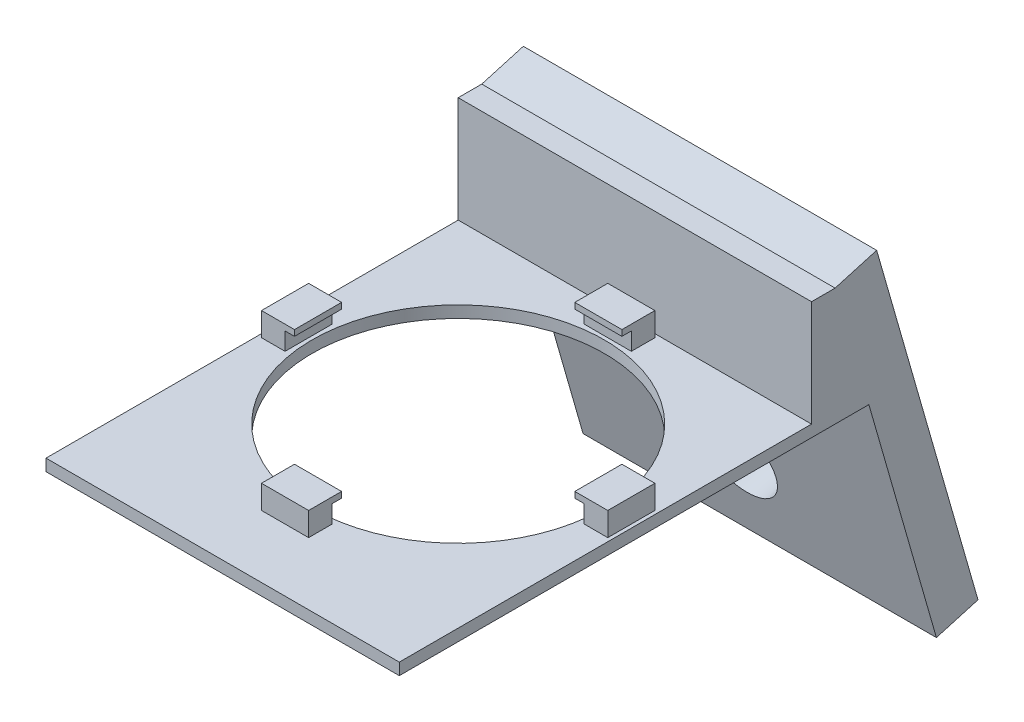
from build123d import *

# Parameters (mm, degrees)
SKETCH1_W               = 30
SKETCH1_H               = 30
BOSS_EXTRUDE1_DEPTH     = 1
SKETCH2_R               = 12.4
CUT_EXTRUDE1_DEPTH      = 22.236760582
SKETCH4_W               = 2
SKETCH4_H               = 4
SKETCH4_W_2             = 4
SKETCH4_H_2             = 2
BOSS_EXTRUDE2_DEPTH     = 2
SKETCH5_W               = 4
SKETCH5_H               = 0.5
BOSS_EXTRUDE3_DEPTH     = 0.8
SKETCH6_W               = 4
SKETCH6_H               = 0.5
BOSS_EXTRUDE4_DEPTH     = 0.8
SKETCH7_W               = 4
SKETCH7_H               = 0.5
BOSS_EXTRUDE5_DEPTH     = 0.8
SKETCH8_W               = 4
SKETCH8_H               = 0.5
BOSS_EXTRUDE6_DEPTH     = 0.8
SKETCH11_W              = 38.930666634
SKETCH11_H              = 2
BOSS_EXTRUDE9_DEPTH     = 10
BOSS_EXTRUDE10_DEPTH    = 30
BOSS_EXTRUDE11_DEPTH    = 30
CUT_EXTRUDE2_DEPTH      = 45.684189659
CUT_EXTRUDE2_DEPTH_BACK = 45.684189659
SKETCH14_W              = 8.930666634
SKETCH14_H              = 10
SKETCH15_W              = 29.996322287
SKETCH15_H              = 1
BOSS_EXTRUDE12_DEPTH    = 5
SKETCH20_W              = 30
SKETCH20_H              = 3.6732435
BOSS_EXTRUDE16_DEPTH    = 90
CUT_EXTRUDE3_DEPTH      = 80.886258607
SKETCH23_W              = 30
SKETCH23_H              = 55.569719249
CUT_EXTRUDE5_DEPTH      = 10
SKETCH24_W              = 30
SKETCH24_H              = 3.6732435
BOSS_EXTRUDE17_DEPTH    = 76.2
SKETCH25_W              = 30
SKETCH25_H              = 3.6732435
CUT_EXTRUDE6_DEPTH      = 25.4
SKETCH26_W              = 30
SKETCH26_H              = 3.6732435
BOSS_EXTRUDE18_DEPTH    = 17.8
SKETCH27_W              = 30
SKETCH27_H              = 71.821297676
CUT_EXTRUDE7_DEPTH      = 10
SKETCH28_R              = 3.375
CUT_EXTRUDE8_DEPTH      = 10


with BuildPart() as part:
    # Sketch1 → Boss-Extrude1 (new body)
    with BuildSketch(Plane(origin=(0, 0, 0), x_dir=(1, 0, 0), z_dir=(0, 1, 0))):
        Rectangle(SKETCH1_W, SKETCH1_H)
    extrude(amount=BOSS_EXTRUDE1_DEPTH)

    # Sketch2 → Cut-Extrude1 (cut, through all)
    with BuildSketch(Plane(origin=(0, 1, 0), x_dir=(1, 0, 0), z_dir=(0, 1, 0))):
        with Locations(Location((0, 0, 0), (0, 0, 270))):
            Circle(SKETCH2_R)
    extrude(amount=-CUT_EXTRUDE1_DEPTH, mode=Mode.SUBTRACT)

    # Sketch4 → Boss-Extrude2 (add)
    with BuildSketch(Plane(origin=(0, 1, 0), x_dir=(1, 0, 0), z_dir=(0, 1, 0))):
        with Locations((13.7, 0)):
            Rectangle(SKETCH4_W, SKETCH4_H)
        with Locations((-13.7, 0)):
            Rectangle(SKETCH4_W, SKETCH4_H)
        with Locations((0, 13.7)):
            Rectangle(SKETCH4_W_2, SKETCH4_H_2)
        with Locations((0, -13.7)):
            Rectangle(SKETCH4_W_2, SKETCH4_H_2)
    extrude(amount=BOSS_EXTRUDE2_DEPTH)

    # Sketch5 → Boss-Extrude3 (add)
    with BuildSketch(Plane.ZY.offset(-12.7)):
        with Locations((0, 2.75)):
            Rectangle(SKETCH5_W, SKETCH5_H)
    extrude(amount=BOSS_EXTRUDE3_DEPTH)

    # Sketch6 → Boss-Extrude4 (add)
    with BuildSketch(Plane(origin=(0, 0, 12.7), x_dir=(-1, 0, 0), z_dir=(0, 0, -1))):
        with Locations((0, 2.75)):
            Rectangle(SKETCH6_W, SKETCH6_H)
    extrude(amount=BOSS_EXTRUDE4_DEPTH)

    # Sketch7 → Boss-Extrude5 (add)
    with BuildSketch(Plane(origin=(-12.7, 0, 0), x_dir=(0, 0, -1), z_dir=(1, 0, 0))):
        with Locations((0, 2.75)):
            Rectangle(SKETCH7_W, SKETCH7_H)
    extrude(amount=BOSS_EXTRUDE5_DEPTH)

    # Sketch8 → Boss-Extrude6 (add)
    with BuildSketch(Plane.XY.offset(-12.7)):
        with Locations((0, 2.75)):
            Rectangle(SKETCH8_W, SKETCH8_H)
    extrude(amount=BOSS_EXTRUDE6_DEPTH)

    # Sketch11 → Boss-Extrude9 (add)
    with BuildSketch(Plane.XZ):
        with Locations((4.465333317, -16)):
            Rectangle(SKETCH11_W, SKETCH11_H)
    extrude(amount=-BOSS_EXTRUDE9_DEPTH)



with BuildPart() as body_2:
    # Sketch12 → Boss-Extrude10 (new body)
    with BuildSketch(Plane.ZY.offset(15)):
        Polygon((-17, 10), (-25.602361573, -20), (-30.365256607, -18.634261826), (-21.762895034, 11.365738174), align=None)
    extrude(amount=-BOSS_EXTRUDE10_DEPTH)


with BuildPart() as part_1:
    add(part.part)

    add(body_2.part)  # Boss-Extrude11 merges body 2
    # Sketch13 → Boss-Extrude11 (add)
    with BuildSketch(Plane.ZY.offset(15)):
        Polygon((-17, 0), (-25.021968012, 0), (-21.762895034, 11.365738174), (-17, 10), align=None)
    extrude(amount=-BOSS_EXTRUDE11_DEPTH)

    # Sketch14 → Cut-Extrude2 (cut, two sides: drawn at the far end of the back side and taken through both)
    with BuildSketch(Plane(origin=(0, 0, -17), x_dir=(-1, 0, 0), z_dir=(0, 0, -1)).offset(-CUT_EXTRUDE2_DEPTH_BACK)):
        with Locations((-19.465333317, 5)):
            Rectangle(SKETCH14_W, SKETCH14_H)
    extrude(amount=CUT_EXTRUDE2_DEPTH + CUT_EXTRUDE2_DEPTH_BACK, mode=Mode.SUBTRACT)

    # Sketch15 → Boss-Extrude12 (add)
    with BuildSketch(Plane.XY.offset(15)):
        with Locations((0.001838857, 0.5)):
            Rectangle(SKETCH15_W, SKETCH15_H)
    extrude(amount=BOSS_EXTRUDE12_DEPTH)

    # Sketch20 → Boss-Extrude16 (add)
    with BuildSketch(Plane(origin=(0, -25.264073265, -7.244356434), x_dir=(1, 0, 0), z_dir=(0, -0.9612616959383165, -0.2756373558170081))):
        with Locations((0, -20.934444139)):
            Rectangle(SKETCH20_W, SKETCH20_H)
    extrude(amount=-BOSS_EXTRUDE16_DEPTH)

    # Sketch21 → Cut-Extrude3 (cut, through all)
    with BuildSketch(Plane(origin=(15, 0, 0), x_dir=(0, 0, -1), z_dir=(1, 0, 0))):
        Polygon((21.762895034, 11.365738174), (20.530948276, 11.012483126), (29.133309849, -18.987516874), (30.365256607, -18.634261826), align=None)
    extrude(amount=-CUT_EXTRUDE3_DEPTH, mode=Mode.SUBTRACT)

    # Sketch23 → Cut-Extrude5 (cut)
    with BuildSketch(Plane(origin=(0, 6.276556391, -21.888953415), x_dir=(-1, 0, 0), z_dir=(0, 0.2756373558170081, -0.9612616959383165))):
        with Locations((0, 35.932939211)):
            Rectangle(SKETCH23_W, SKETCH23_H)
    extrude(amount=-CUT_EXTRUDE5_DEPTH, mode=Mode.SUBTRACT)

    # Sketch24 → Boss-Extrude17 (add)
    with BuildSketch(Plane(origin=(0, 7.832436802, 2.245915112), x_dir=(1, 0, 0), z_dir=(0, 0.9612616959383165, 0.2756373558170081))):
        with Locations((0, 20.934444139)):
            Rectangle(SKETCH24_W, SKETCH24_H)
    extrude(amount=BOSS_EXTRUDE17_DEPTH)

    # Sketch25 → Cut-Extrude6 (cut)
    with BuildSketch(Plane(origin=(0, 81.080578032, 23.249481625), x_dir=(1, 0, 0), z_dir=(0, 0.9612616959383165, 0.27563735581700777))):
        with Locations((0, 20.934444139)):
            Rectangle(SKETCH25_W, SKETCH25_H)
    extrude(amount=-CUT_EXTRUDE6_DEPTH, mode=Mode.SUBTRACT)

    # Sketch26 → Boss-Extrude18 (add)
    with BuildSketch(Plane(origin=(0, 56.664530955, 16.248292788), x_dir=(1, 0, 0), z_dir=(0, 0.9612616959383156, 0.2756373558170107))):
        with Locations((0, 20.934444139)):
            Rectangle(SKETCH26_W, SKETCH26_H)
    extrude(amount=BOSS_EXTRUDE18_DEPTH)

    # Sketch27 → Cut-Extrude7 (cut)
    with BuildSketch(Plane(origin=(0, 5.264073265, -18.358005138), x_dir=(1, 0, 0), z_dir=(0, -0.2756373558170081, 0.9612616959383165))):
        with Locations((0, 40.837430748)):
            Rectangle(SKETCH27_W, SKETCH27_H)
    extrude(amount=-CUT_EXTRUDE7_DEPTH, mode=Mode.SUBTRACT)

    # Sketch28 → Cut-Extrude8 (cut)
    with BuildSketch(Plane(origin=(0, 5.264073265, -18.358005138), x_dir=(1, 0, 0), z_dir=(0, -0.27563735581700294, 0.9612616959383178))):
        with Locations(Location((0, -19.05, 0), (0, 0, 270))):
            Circle(SKETCH28_R)
    extrude(amount=-CUT_EXTRUDE8_DEPTH, mode=Mode.SUBTRACT)


solid = part_1.part
